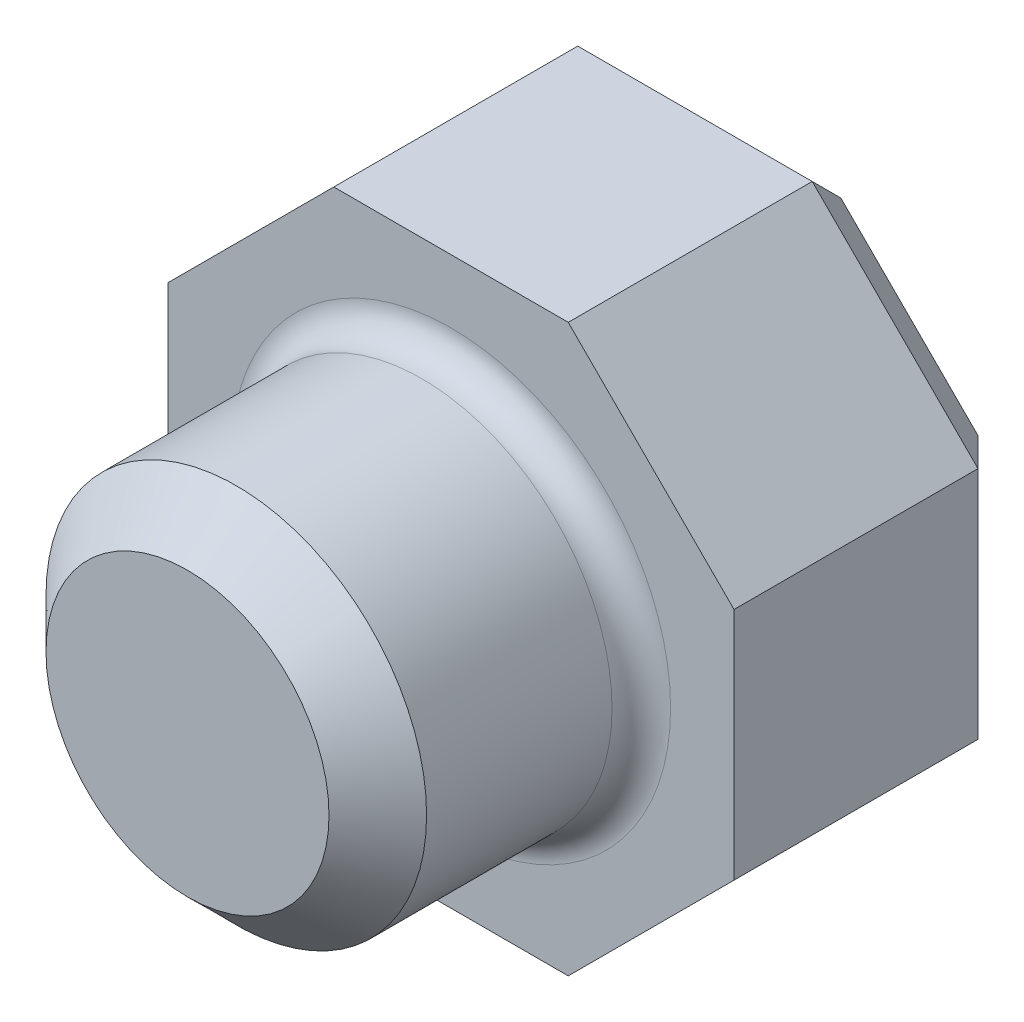
from build123d import *

# Parameters (mm, degrees)
SALIENTE_EXTRUIR1_DEPTH = 6
CROQUIS2_R              = 3.9
SALIENTE_EXTRUIR2_DEPTH = 5.4
CHAFL_N1_SIZE           = 1
REDONDEO1_R             = 0.6
CHAFL_N2_SIZE           = 1


with BuildPart() as part:
    # Croquis1 → Saliente-Extruir1 (new body)
    with BuildSketch(Plane(origin=(0, 0, 0), x_dir=(0, 1, 0), z_dir=(0, 0, 1))):
        Polygon((5.8, -2.402438662), (5.8, 2.402438662), (2.402438662, 5.8), (-2.402438662, 5.8), (-5.8, 2.402438662), (-5.8, -2.402438662), (-2.402438662, -5.8), (2.402438662, -5.8), align=None)
    extrude(amount=SALIENTE_EXTRUIR1_DEPTH)

    # Croquis2 → Saliente-Extruir2 (add)
    with BuildSketch(Plane.XY.offset(6)):
        with Locations(Location((0, 0, 0), (0, 0, 180))):
            Circle(CROQUIS2_R)
    extrude(amount=SALIENTE_EXTRUIR2_DEPTH)

    # Chaflán1
    chafl_n1_edges = [part.edges().sort_by_distance(p)[0] for p in [
        (3.9, 0, 11.4),
    ]]
    chamfer(chafl_n1_edges, length=CHAFL_N1_SIZE)

    # Redondeo1
    redondeo1_edges = [part.edges().sort_by_distance(p)[0] for p in [
        (3.9, 0, 6),
    ]]
    fillet(redondeo1_edges, radius=REDONDEO1_R)

    # Chaflán2
    chafl_n2_edges = [part.edges().sort_by_distance(p)[0] for p in [
        (-5.8, 0, 0),
        (-4.101219331, 4.101219331, 0),
        (0, 5.8, 0),
        (4.101219331, 4.101219331, 0),
        (5.8, 0, 0),
        (4.101219331, -4.101219331, 0),
        (0, -5.8, 0),
        (-4.101219331, -4.101219331, 0),
    ]]
    chamfer(chafl_n2_edges, length=CHAFL_N2_SIZE)


solid = part.part
